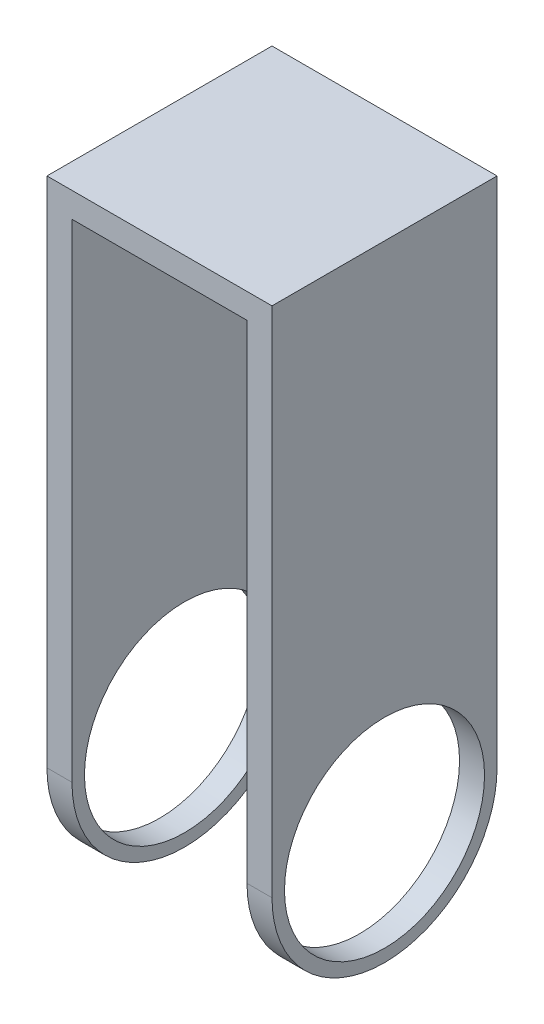
from build123d import *

# Parameters (mm, degrees)
SKETCH1_W           = 8
SKETCH1_H           = 9
BOSS_EXTRUDE1_DEPTH = 1
SKETCH6_R           = 4
BOSS_EXTRUDE2_DEPTH = 1
SKETCH9_R           = 4
BOSS_EXTRUDE3_DEPTH = 1


with BuildPart() as part:
    # Sketch1 → Boss-Extrude1 (new body)
    with BuildSketch(Plane(origin=(0, 0, 0), x_dir=(1, 0, 0), z_dir=(0, 1, 0))):
        Rectangle(SKETCH1_W, SKETCH1_H)
    extrude(amount=BOSS_EXTRUDE1_DEPTH)

    # Sketch6 → Boss-Extrude2 (add)
    with BuildSketch(Plane.ZY.offset(-4)):
        with BuildLine():
            Line((4.5, 1), (4.5, -19.5))
            ThreePointArc((4.5, -19.5), (0, -24), (-4.5, -19.5))
            Line((-4.5, -19.5), (-4.5, 1))
            Line((-4.5, 1), (4.5, 1))
        make_face()
        with Locations((0, -19.5)):
            Circle(SKETCH6_R, mode=Mode.SUBTRACT)
    extrude(amount=BOSS_EXTRUDE2_DEPTH)

    # Sketch9 → Boss-Extrude3 (add)
    with BuildSketch(Plane(origin=(-4, 0, 0), x_dir=(0, 0, -1), z_dir=(1, 0, 0))):
        with BuildLine():
            Line((-4.5, 1), (-4.5, -19.5))
            ThreePointArc((-4.5, -19.5), (0, -24), (4.5, -19.5))
            Line((4.5, -19.5), (4.5, 1))
            Line((4.5, 1), (-4.5, 1))
        make_face()
        with Locations(Location((0, -19.5, 0), (0, 0, 180))):
            Circle(SKETCH9_R, mode=Mode.SUBTRACT)
    extrude(amount=-BOSS_EXTRUDE3_DEPTH)


solid = part.part
